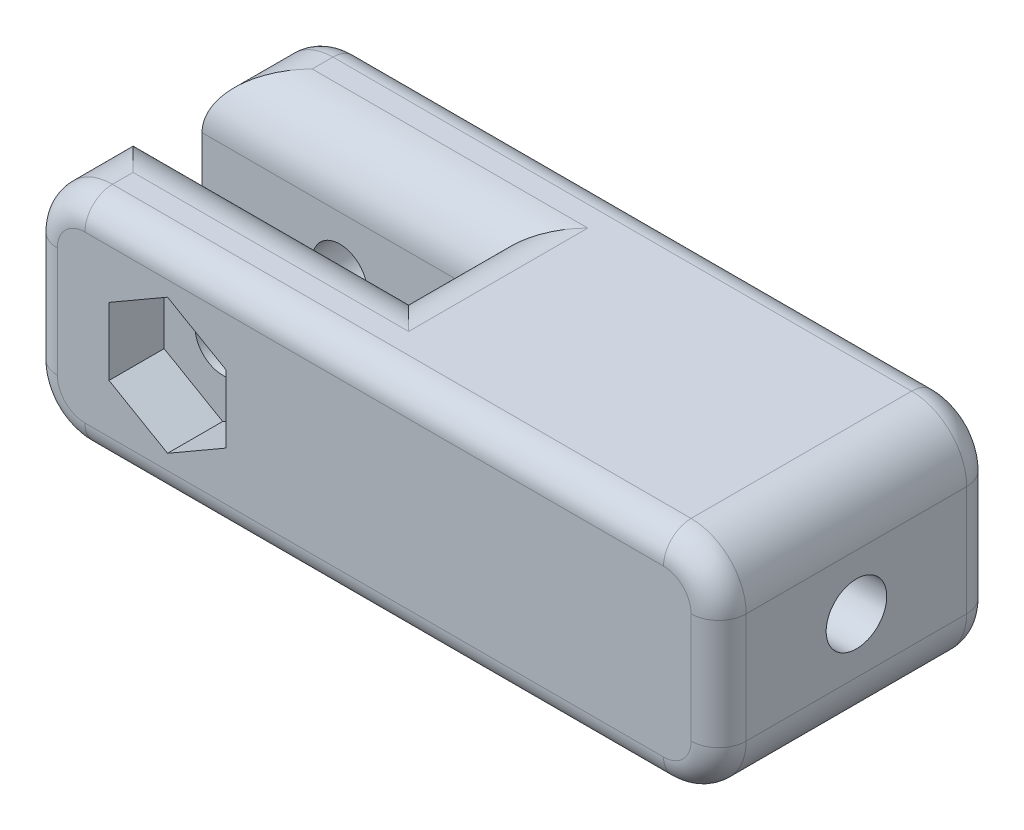
from build123d import *

# Parameters (mm, degrees)
BOSS_EXTRUDE1_DEPTH = 8
SKETCH2_R           = 1.1
CUT_EXTRUDE1_DEPTH  = 18.720045147
SKETCH3_R           = 1
CUT_EXTRUDE2_DEPTH  = 29.08914381
CUT_EXTRUDE3_DEPTH  = 2
FILLET1_R           = 2
FILLET2_R           = 1


with BuildPart() as part:
    # Sketch1 → Boss-Extrude1 (new body)
    with BuildSketch(Plane(origin=(0, 0, 0), x_dir=(1, 0, 0), z_dir=(0, 1, 0))):
        Polygon((-25, 1.25), (-25, 5), (0, 5), (0, -5), (-25, -5), (-25, -1.25), (-15, -1.25), (-15, 1.25), align=None)
    extrude(amount=BOSS_EXTRUDE1_DEPTH)

    # Sketch2 → Cut-Extrude1 (cut, through all)
    with BuildSketch(Plane.ZY.offset(15)):
        with Locations((0, 4)):
            Circle(SKETCH2_R)
    extrude(amount=-CUT_EXTRUDE1_DEPTH, mode=Mode.SUBTRACT)

    # Sketch3 → Cut-Extrude2 (cut, through all)
    with BuildSketch(Plane.XY.offset(5)):
        with Locations((-20, 4)):
            Circle(SKETCH3_R)
    extrude(amount=-CUT_EXTRUDE2_DEPTH, mode=Mode.SUBTRACT)

    # Sketch4 → Cut-Extrude3 (cut)
    with BuildSketch(Plane.XY.offset(5)):
        Polygon((-20, 1.546261356), (-17.875, 2.773130678), (-17.875, 5.226869322), (-20, 6.453738644), (-22.125, 5.226869322), (-22.125, 2.773130678), align=None)
    cut_extrude3 = extrude(amount=-CUT_EXTRUDE3_DEPTH, mode=Mode.SUBTRACT)

    # Mirror1: Cut-Extrude3 across plane
    add(cut_extrude3.mirror(Plane.XY), mode=Mode.SUBTRACT)

    # Fillet1
    fillet1_edges = [part.edges().sort_by_distance(p)[0] for p in [
        (0, 0, 0),
        (-15, 8, 0),
        (-25, 0, 3.125),
        (-20, 0, 1.25),
        (-15, 0, 0),
        (-20, 0, -1.25),
        (-20, 8, 1.25),
        (-25, 8, 3.125),
        (0, 8, 0),
        (-25, 8, -3.125),
        (-20, 8, -1.25),
        (-25, 0, -3.125),
    ]]
    fillet(fillet1_edges, radius=FILLET1_R)

    # Fillet2
    fillet2_edges = [part.edges().sort_by_distance(p)[0] for p in [
        (-25, 4, 5),
        (-12.5, 8, 5),
        (-12.5, 8, -5),
        (-12.5, 0, 5),
        (0, 4, 5),
        (-0.585786438, 7.414213562, 5),
        (-24.414213562, 0.585786438, 5),
        (-0.585786438, 0.585786438, 5),
        (-24.414213562, 7.414213562, 5),
        (-25, 4, -5),
        (-12.5, 0, -5),
        (0, 4, -5),
        (-0.585786438, 7.414213562, -5),
        (-24.414213562, 0.585786438, -5),
        (-0.585786438, 0.585786438, -5),
        (-24.414213562, 7.414213562, -5),
    ]]
    fillet(fillet2_edges, radius=FILLET2_R)


solid = part.part
